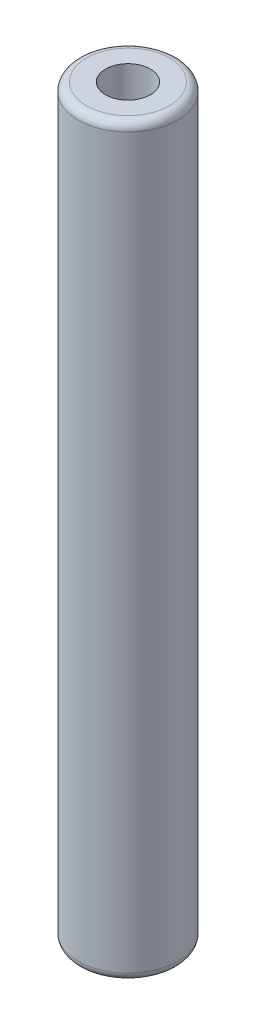
from build123d import *

# Parameters (mm, degrees)
BOSS_EXTRUDE1_DEPTH       = 22.5
BOSS_EXTRUDE1_DEPTH_BACK  = 22.5
SKETCH1_R                 = 3
F_6_32_TAPPED_HOLE1_D     = 2.7051
F_6_32_TAPPED_HOLE1_DEPTH = 10.35
F_6_32_TAPPED_HOLE1_TIP   = 0.81269403
FILLET1_R                 = 0.5
F_6_32_TAPPED_HOLE2_D     = 2.7051
F_6_32_TAPPED_HOLE2_DEPTH = 10.35
F_6_32_TAPPED_HOLE2_TIP   = 0.81269403


with BuildPart() as part:
    # Sketch1 → Boss-Extrude1 (new, two sides: drawn at the far end of the back side and taken through both)
    with BuildSketch(Plane(origin=(0, 0, 0), x_dir=(1, 0, 0), z_dir=(0, 1, 0)).offset(-BOSS_EXTRUDE1_DEPTH_BACK)):
        Circle(SKETCH1_R)
    extrude(amount=BOSS_EXTRUDE1_DEPTH + BOSS_EXTRUDE1_DEPTH_BACK)

    # #6-32 Tapped Hole1
    with Locations(Plane(origin=(0, 22.5, 0), x_dir=(1, 0, 0), z_dir=(0, 1, 0))):
        with Locations((0, 0)):
            Hole(F_6_32_TAPPED_HOLE1_D / 2, depth=F_6_32_TAPPED_HOLE1_DEPTH)
            with Locations((0, 0, -(F_6_32_TAPPED_HOLE1_DEPTH + F_6_32_TAPPED_HOLE1_TIP / 2))):  # 118° drill point
                Cone(0, F_6_32_TAPPED_HOLE1_D / 2, F_6_32_TAPPED_HOLE1_TIP, mode=Mode.SUBTRACT)

    # Fillet1
    fillet1_edges = [part.edges().sort_by_distance(p)[0] for p in [
        (-3, 22.5, 0),
        (-3, -22.5, 0),
    ]]
    fillet(fillet1_edges, radius=FILLET1_R)

    # #6-32 Tapped Hole2
    with Locations(Plane(origin=(0, -22.5, 0), x_dir=(-1, 0, 0), z_dir=(0, -1, 0))):
        with Locations((0, 0)):
            Hole(F_6_32_TAPPED_HOLE2_D / 2, depth=F_6_32_TAPPED_HOLE2_DEPTH)
            with Locations((0, 0, -(F_6_32_TAPPED_HOLE2_DEPTH + F_6_32_TAPPED_HOLE2_TIP / 2))):  # 118° drill point
                Cone(0, F_6_32_TAPPED_HOLE2_D / 2, F_6_32_TAPPED_HOLE2_TIP, mode=Mode.SUBTRACT)


solid = part.part
